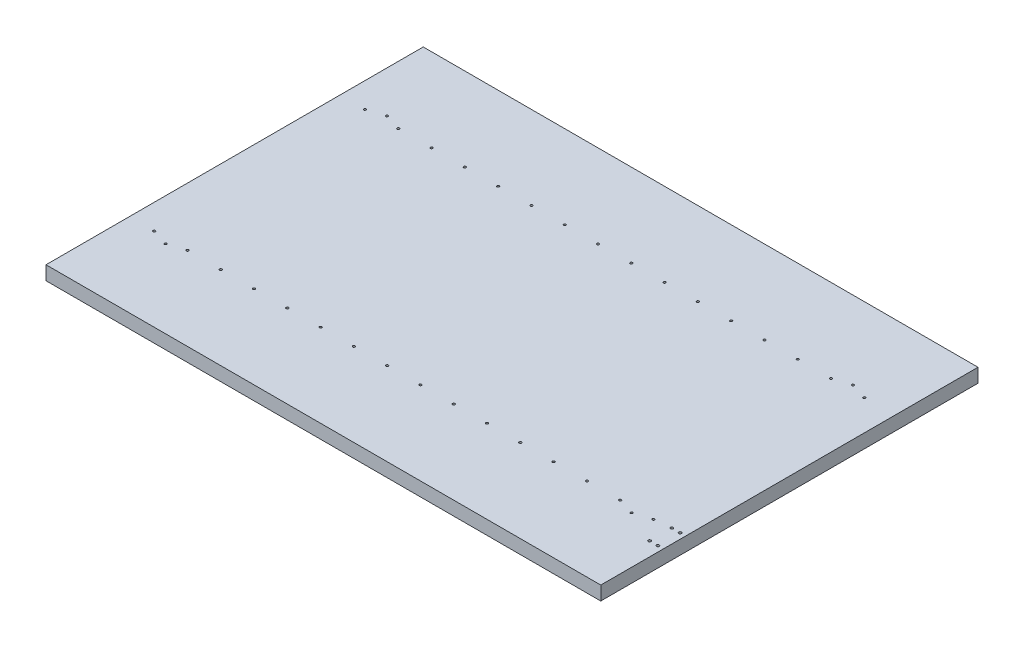
from build123d import *

# Parameters (mm, degrees)
SKETCH1_W                      = 1000
SKETCH1_H                      = 680
BOSS_EXTRUDE1_DEPTH            = 12.5
M5X0_8_TAPPED_HOLE1_D          = 4.2
M6_TAPPED_HOLE1_D              = 5
F_4_0MM_DOWEL_HOLE1_AT_2_COUNT = 2
F_4_0MM_DOWEL_HOLE1_AT_2_PITCH = 840


with BuildPart() as part:
    # Sketch1 → Boss-Extrude1 (new, symmetric)
    with BuildSketch(Plane(origin=(0, 0, 0), x_dir=(1, 0, 0), z_dir=(0, 1, 0))):
        Rectangle(SKETCH1_W, SKETCH1_H)
    extrude(amount=BOSS_EXTRUDE1_DEPTH, both=True)

    # M5x0.8 Tapped Hole1 (through all)
    with Locations(Plane(origin=(0, 12.5, 0), x_dir=(1, 0, 0), z_dir=(0, 1, 0))):
        with Locations((-275, 190), (-215, 190), (-155, 190), (-95, 190), (-35, 190), (25, 190), (85, 190), (145, 190), (205, 190), (265, 190), (325, 190), (385, 190), (445, 190), (-335, 190), (-395, 190), (-455, 190)):
            m5x0_8_tapped_hole1 = Hole(M5X0_8_TAPPED_HOLE1_D / 2)

    # Mirror1: M5x0.8 Tapped Hole1 across plane
    add(m5x0_8_tapped_hole1.mirror(Plane.XY), mode=Mode.SUBTRACT)

    # M6 Tapped Hole1 (through all)
    with Locations(Plane(origin=(0, 12.5, 0), x_dir=(1, 0, 0), z_dir=(0, 1, 0))):
        with Locations((475, -187), (490, -187), (490, -227), (475, -227)):
            Hole(M6_TAPPED_HOLE1_D / 2)

    # Sketch12 → Ø4.0mm Dowel Hole1 (revolve, cut)
    with BuildSketch(Plane(origin=(415, 12.5, 199.5), x_dir=(0, 0, 1), z_dir=(1, 0, 0))):
        Polygon((0, 0), (0, 21.201721238), (2, 20), (2, 0), align=None)
    f_4_0mm_dowel_hole1 = revolve(axis=Axis((415, 18.85, 199.5), (0, -1, 0)), mode=Mode.SUBTRACT)

    # Ø4.0mm Dowel Hole1 at 2: Ø4.0mm Dowel Hole1 ×2
    with Locations(*[(-i * F_4_0MM_DOWEL_HOLE1_AT_2_PITCH, 0, 0) for i in range(1, F_4_0MM_DOWEL_HOLE1_AT_2_COUNT)]):
        add(f_4_0mm_dowel_hole1, mode=Mode.SUBTRACT)

    # Mirror2: Ø4.0mm Dowel Hole1 across plane
    add(f_4_0mm_dowel_hole1.mirror(Plane.XY), mode=Mode.SUBTRACT)

    # Mirror2 copy 1 sketch → Mirror2 copy 1 (revolve, cut)
    with BuildSketch(Plane(origin=(-425, 12.5, -199.5), x_dir=(0, 0, -1), z_dir=(1, 0, 0))):
        Polygon((0, 0), (0, -21.201721238), (2, -20), (2, 0), align=None)
    revolve(axis=Axis((-425, 18.85, -199.5), (0, 1, 0)), mode=Mode.SUBTRACT)


solid = part.part
